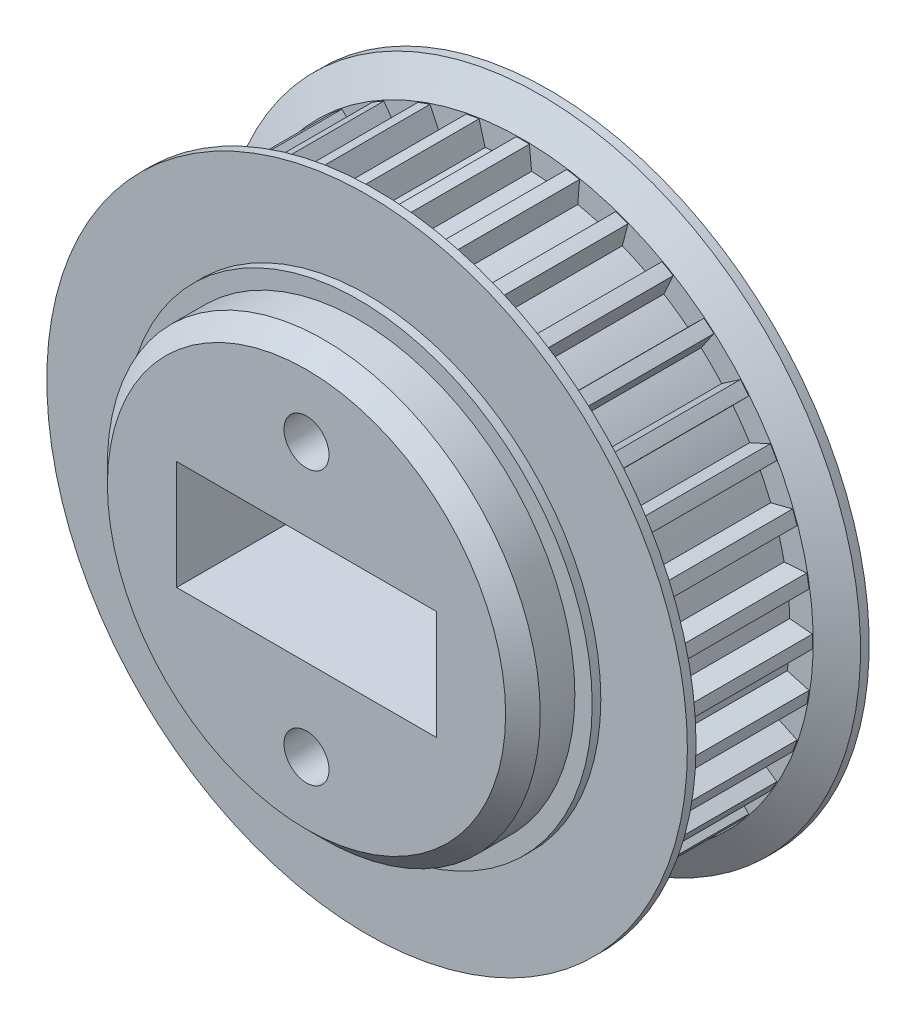
from build123d import *
from OCP.BRepFilletAPI import BRepFilletAPI_MakeChamfer
from build123d.topology import SkipClean

# Parameters (mm, degrees)
CROQUIS1_R              = 2
SALIENTE_EXTRUIR1_DEPTH = 7.5
CROQUIS2_R              = 18.5
CROQUIS2_R_2            = 2
SALIENTE_EXTRUIR2_DEPTH = 1.5
SALIENTE_EXTRUIR4_START = 6
CROQUIS4_R              = 7.5
CROQUIS4_R_2            = 2
SALIENTE_EXTRUIR4_DEPTH = 6
SALIENTE_EXTRUIR6_START = 1.5
CROQUIS6_R              = 18.5
CROQUIS6_R_2            = 2
SALIENTE_EXTRUIR6_DEPTH = 1.5
SALIENTE_EXTRUIR5_START = 0.5
CROQUIS5_R              = 13.5
CROQUIS5_R_2            = 2
SALIENTE_EXTRUIR5_DEPTH = 0.5
CHAFL_N2_SIZE           = 1
CHAFL_N2_SIZE2          = 1.732050808
CROQUIS3_R              = 12.5
CROQUIS3_R_2            = 2
SALIENTE_EXTRUIR7_DEPTH = 3.5
CHAFL_N4_SIZE           = 1
CROQUIS7_R              = 13.5
CROQUIS7_R_2            = 2
SALIENTE_EXTRUIR8_DEPTH = 0.5
CROQUIS8_R              = 1.3
CROQUIS8_W              = 15
CROQUIS8_H              = 6.3
CORTAR_EXTRUIR1_DEPTH   = 27
CROQUIS9_R              = 1.3
CORTAR_EXTRUIR2_DEPTH   = 33.04293994


with BuildPart() as part:
    # Croquis1 → Saliente-Extruir1 (new body)
    with BuildSketch(Plane.XY):
        with BuildLine():
            Line((-0.375, 16.714216942), (-0.5, 15.410313844))
            ThreePointArc((-0.5, 15.410313844), (-1.343804123, 15.359751406), (-2.18356904, 15.263020639))
            Line((-2.18356904, 15.263020639), (-2.533090406, 16.525408497))
            ThreePointArc((-2.533090406, 16.525408497), (-2.903123715, 16.464432747), (-3.271696221, 16.395172363))
            Line((-3.271696221, 16.395172363), (-3.168376793, 15.089372461))
            ThreePointArc((-3.168376793, 15.089372461), (-3.99058156, 14.893053132), (-4.800791439, 14.651968275))
            Line((-4.800791439, 14.651968275), (-5.364214141, 15.834483876))
            ThreePointArc((-5.364214141, 15.834483876), (-5.718037486, 15.710178876), (-6.068983607, 15.577968769))
            Line((-6.068983607, 15.577968769), (-5.74048406, 14.309948132))
            ThreePointArc((-5.74048406, 14.309948132), (-6.516107195, 13.973836975), (-7.27214422, 13.595723269))
            Line((-7.27214422, 13.595723269), (-8.032348945, 14.662436476))
            ThreePointArc((-8.032348945, 14.662436476), (-8.35921158, 14.478579169), (-8.681867997, 14.287436476))
            Line((-8.681867997, 14.287436476), (-8.138169624, 13.095723269))
            ThreePointArc((-8.138169624, 13.095723269), (-8.843644211, 12.630032852), (-9.522536579, 12.126379092))
            Line((-9.522536579, 12.126379092), (-10.45642489, 13.044878363))
            ThreePointArc((-10.45642489, 13.044878363), (-10.746395261, 12.80705516), (-11.030958222, 12.562787656))
            Line((-11.030958222, 12.562787656), (-10.288581022, 11.483591482))
            ThreePointArc((-10.288581022, 11.483591482), (-10.902471572, 10.902471572), (-11.483591482, 10.288581022))
            Line((-11.483591482, 10.288581022), (-12.562787656, 11.030958222))
            ThreePointArc((-12.562787656, 11.030958222), (-12.80705516, 10.746395261), (-13.044878363, 10.45642489))
            Line((-13.044878363, 10.45642489), (-12.126379092, 9.522536579))
            ThreePointArc((-12.126379092, 9.522536579), (-12.630032852, 8.843644211), (-13.095723269, 8.138169624))
            Line((-13.095723269, 8.138169624), (-14.287436476, 8.681867997))
            ThreePointArc((-14.287436476, 8.681867997), (-14.478579169, 8.35921158), (-14.662436476, 8.032348945))
            Line((-14.662436476, 8.032348945), (-13.595723269, 7.27214422))
            ThreePointArc((-13.595723269, 7.27214422), (-13.973836975, 6.516107195), (-14.309948132, 5.74048406))
            Line((-14.309948132, 5.74048406), (-15.577968769, 6.068983607))
            ThreePointArc((-15.577968769, 6.068983607), (-15.710178876, 5.718037486), (-15.834483876, 5.364214141))
            Line((-15.834483876, 5.364214141), (-14.651968275, 4.800791439))
            ThreePointArc((-14.651968275, 4.800791439), (-14.893053132, 3.99058156), (-15.089372461, 3.168376793))
            Line((-15.089372461, 3.168376793), (-16.395172363, 3.271696221))
            ThreePointArc((-16.395172363, 3.271696221), (-16.464432747, 2.903123715), (-16.525408497, 2.533090406))
            Line((-16.525408497, 2.533090406), (-15.263020639, 2.18356904))
            ThreePointArc((-15.263020639, 2.18356904), (-15.359751406, 1.343804123), (-15.410313844, 0.5))
            Line((-15.410313844, 0.5), (-16.714216942, 0.375))
            ThreePointArc((-16.714216942, 0.375), (-16.718423161, 0), (-16.714216942, -0.375))
            Line((-16.714216942, -0.375), (-15.410313844, -0.5))
            ThreePointArc((-15.410313844, -0.5), (-15.359751406, -1.343804123), (-15.263020639, -2.18356904))
            Line((-15.263020639, -2.18356904), (-16.525408497, -2.533090406))
            ThreePointArc((-16.525408497, -2.533090406), (-16.464432747, -2.903123715), (-16.395172363, -3.271696221))
            Line((-16.395172363, -3.271696221), (-15.089372461, -3.168376793))
            ThreePointArc((-15.089372461, -3.168376793), (-14.893053132, -3.99058156), (-14.651968275, -4.800791439))
            Line((-14.651968275, -4.800791439), (-15.834483876, -5.364214141))
            ThreePointArc((-15.834483876, -5.364214141), (-15.710178876, -5.718037486), (-15.577968769, -6.068983607))
            Line((-15.577968769, -6.068983607), (-14.309948132, -5.74048406))
            ThreePointArc((-14.309948132, -5.74048406), (-13.973836975, -6.516107195), (-13.595723269, -7.27214422))
            Line((-13.595723269, -7.27214422), (-14.662436476, -8.032348945))
            ThreePointArc((-14.662436476, -8.032348945), (-14.478579169, -8.35921158), (-14.287436476, -8.681867997))
            Line((-14.287436476, -8.681867997), (-13.095723269, -8.138169624))
            ThreePointArc((-13.095723269, -8.138169624), (-12.630032852, -8.843644211), (-12.126379092, -9.522536579))
            Line((-12.126379092, -9.522536579), (-13.044878363, -10.45642489))
            ThreePointArc((-13.044878363, -10.45642489), (-12.80705516, -10.746395261), (-12.562787656, -11.030958222))
            Line((-12.562787656, -11.030958222), (-11.483591482, -10.288581022))
            ThreePointArc((-11.483591482, -10.288581022), (-10.902471572, -10.902471572), (-10.288581022, -11.483591482))
            Line((-10.288581022, -11.483591482), (-11.030958222, -12.562787656))
            ThreePointArc((-11.030958222, -12.562787656), (-10.746395261, -12.80705516), (-10.45642489, -13.044878363))
            Line((-10.45642489, -13.044878363), (-9.522536579, -12.126379092))
            ThreePointArc((-9.522536579, -12.126379092), (-8.843644211, -12.630032852), (-8.138169624, -13.095723269))
            Line((-8.138169624, -13.095723269), (-8.681867997, -14.287436476))
            ThreePointArc((-8.681867997, -14.287436476), (-8.35921158, -14.478579169), (-8.032348945, -14.662436476))
            Line((-8.032348945, -14.662436476), (-7.27214422, -13.595723269))
            ThreePointArc((-7.27214422, -13.595723269), (-6.516107195, -13.973836975), (-5.74048406, -14.309948132))
            Line((-5.74048406, -14.309948132), (-6.068983607, -15.577968769))
            ThreePointArc((-6.068983607, -15.577968769), (-5.718037486, -15.710178876), (-5.364214141, -15.834483876))
            Line((-5.364214141, -15.834483876), (-4.800791439, -14.651968275))
            ThreePointArc((-4.800791439, -14.651968275), (-3.99058156, -14.893053132), (-3.168376793, -15.089372461))
            Line((-3.168376793, -15.089372461), (-3.271696221, -16.395172363))
            ThreePointArc((-3.271696221, -16.395172363), (-2.903123715, -16.464432747), (-2.533090406, -16.525408497))
            Line((-2.533090406, -16.525408497), (-2.18356904, -15.263020639))
            ThreePointArc((-2.18356904, -15.263020639), (-1.343804123, -15.359751406), (-0.5, -15.410313844))
            Line((-0.5, -15.410313844), (-0.375, -16.714216942))
            ThreePointArc((-0.375, -16.714216942), (0, -16.718423161), (0.375, -16.714216942))
            Line((0.375, -16.714216942), (0.5, -15.410313844))
            ThreePointArc((0.5, -15.410313844), (1.343804123, -15.359751406), (2.18356904, -15.263020639))
            Line((2.18356904, -15.263020639), (2.533090406, -16.525408497))
            ThreePointArc((2.533090406, -16.525408497), (2.903123715, -16.464432747), (3.271696221, -16.395172363))
            Line((3.271696221, -16.395172363), (3.168376793, -15.089372461))
            ThreePointArc((3.168376793, -15.089372461), (3.99058156, -14.893053132), (4.800791439, -14.651968275))
            Line((4.800791439, -14.651968275), (5.364214141, -15.834483876))
            ThreePointArc((5.364214141, -15.834483876), (5.718037486, -15.710178876), (6.068983607, -15.577968769))
            Line((6.068983607, -15.577968769), (5.74048406, -14.309948132))
            ThreePointArc((5.74048406, -14.309948132), (6.516107195, -13.973836975), (7.27214422, -13.595723269))
            Line((7.27214422, -13.595723269), (8.032348945, -14.662436476))
            ThreePointArc((8.032348945, -14.662436476), (8.35921158, -14.478579169), (8.681867997, -14.287436476))
            Line((8.681867997, -14.287436476), (8.138169624, -13.095723269))
            ThreePointArc((8.138169624, -13.095723269), (8.843644211, -12.630032852), (9.522536579, -12.126379092))
            Line((9.522536579, -12.126379092), (10.45642489, -13.044878363))
            ThreePointArc((10.45642489, -13.044878363), (10.746395261, -12.80705516), (11.030958222, -12.562787656))
            Line((11.030958222, -12.562787656), (10.288581022, -11.483591482))
            ThreePointArc((10.288581022, -11.483591482), (10.902471572, -10.902471572), (11.483591482, -10.288581022))
            Line((11.483591482, -10.288581022), (12.562787656, -11.030958222))
            ThreePointArc((12.562787656, -11.030958222), (12.80705516, -10.746395261), (13.044878363, -10.45642489))
            Line((13.044878363, -10.45642489), (12.126379092, -9.522536579))
            ThreePointArc((12.126379092, -9.522536579), (12.630032852, -8.843644211), (13.095723269, -8.138169624))
            Line((13.095723269, -8.138169624), (14.287436476, -8.681867997))
            ThreePointArc((14.287436476, -8.681867997), (14.478579169, -8.35921158), (14.662436476, -8.032348945))
            Line((14.662436476, -8.032348945), (13.595723269, -7.27214422))
            ThreePointArc((13.595723269, -7.27214422), (13.973836975, -6.516107195), (14.309948132, -5.74048406))
            Line((14.309948132, -5.74048406), (15.577968769, -6.068983607))
            ThreePointArc((15.577968769, -6.068983607), (15.710178876, -5.718037486), (15.834483876, -5.364214141))
            Line((15.834483876, -5.364214141), (14.651968275, -4.800791439))
            ThreePointArc((14.651968275, -4.800791439), (14.893053132, -3.99058156), (15.089372461, -3.168376793))
            Line((15.089372461, -3.168376793), (16.395172363, -3.271696221))
            ThreePointArc((16.395172363, -3.271696221), (16.464432747, -2.903123715), (16.525408497, -2.533090406))
            Line((16.525408497, -2.533090406), (15.263020639, -2.18356904))
            ThreePointArc((15.263020639, -2.18356904), (15.359751406, -1.343804123), (15.410313844, -0.5))
            Line((15.410313844, -0.5), (16.714216942, -0.375))
            ThreePointArc((16.714216942, -0.375), (16.718423161, 0), (16.714216942, 0.375))
            Line((16.714216942, 0.375), (15.410313844, 0.5))
            ThreePointArc((15.410313844, 0.5), (15.359751406, 1.343804123), (15.263020639, 2.18356904))
            Line((15.263020639, 2.18356904), (16.525408497, 2.533090406))
            ThreePointArc((16.525408497, 2.533090406), (16.464432747, 2.903123715), (16.395172363, 3.271696221))
            Line((16.395172363, 3.271696221), (15.089372461, 3.168376793))
            ThreePointArc((15.089372461, 3.168376793), (14.893053132, 3.99058156), (14.651968275, 4.800791439))
            Line((14.651968275, 4.800791439), (15.834483876, 5.364214141))
            ThreePointArc((15.834483876, 5.364214141), (15.710178876, 5.718037486), (15.577968769, 6.068983607))
            Line((15.577968769, 6.068983607), (14.309948132, 5.74048406))
            ThreePointArc((14.309948132, 5.74048406), (13.973836975, 6.516107195), (13.595723269, 7.27214422))
            Line((13.595723269, 7.27214422), (14.662436476, 8.032348945))
            ThreePointArc((14.662436476, 8.032348945), (14.478579169, 8.35921158), (14.287436476, 8.681867997))
            Line((14.287436476, 8.681867997), (13.095723269, 8.138169624))
            ThreePointArc((13.095723269, 8.138169624), (12.630032852, 8.843644211), (12.126379092, 9.522536579))
            Line((12.126379092, 9.522536579), (13.044878363, 10.45642489))
            ThreePointArc((13.044878363, 10.45642489), (12.80705516, 10.746395261), (12.562787656, 11.030958222))
            Line((12.562787656, 11.030958222), (11.483591482, 10.288581022))
            ThreePointArc((11.483591482, 10.288581022), (10.902471572, 10.902471572), (10.288581022, 11.483591482))
            Line((10.288581022, 11.483591482), (11.030958222, 12.562787656))
            ThreePointArc((11.030958222, 12.562787656), (10.746395261, 12.80705516), (10.45642489, 13.044878363))
            Line((10.45642489, 13.044878363), (9.522536579, 12.126379092))
            ThreePointArc((9.522536579, 12.126379092), (8.843644211, 12.630032852), (8.138169624, 13.095723269))
            Line((8.138169624, 13.095723269), (8.681867997, 14.287436476))
            ThreePointArc((8.681867997, 14.287436476), (8.35921158, 14.478579169), (8.032348945, 14.662436476))
            Line((8.032348945, 14.662436476), (7.27214422, 13.595723269))
            ThreePointArc((7.27214422, 13.595723269), (6.516107195, 13.973836975), (5.74048406, 14.309948132))
            Line((5.74048406, 14.309948132), (6.068983607, 15.577968769))
            ThreePointArc((6.068983607, 15.577968769), (5.718037486, 15.710178876), (5.364214141, 15.834483876))
            Line((5.364214141, 15.834483876), (4.800791439, 14.651968275))
            ThreePointArc((4.800791439, 14.651968275), (3.99058156, 14.893053132), (3.168376793, 15.089372461))
            Line((3.168376793, 15.089372461), (3.271696221, 16.395172363))
            ThreePointArc((3.271696221, 16.395172363), (2.903123715, 16.464432747), (2.533090406, 16.525408497))
            Line((2.533090406, 16.525408497), (2.18356904, 15.263020639))
            ThreePointArc((2.18356904, 15.263020639), (1.343804123, 15.359751406), (0.5, 15.410313844))
            Line((0.5, 15.410313844), (0.375, 16.714216942))
            ThreePointArc((0.375, 16.714216942), (0, 16.718423161), (-0.375, 16.714216942))
        make_face()
        Circle(CROQUIS1_R, mode=Mode.SUBTRACT)
    extrude(amount=SALIENTE_EXTRUIR1_DEPTH)

    # Croquis2 → Saliente-Extruir2 (add)
    with BuildSketch(Plane.XY.offset(7.5)):
        Circle(CROQUIS2_R)
        Circle(CROQUIS2_R_2, mode=Mode.SUBTRACT)
    extrude(amount=SALIENTE_EXTRUIR2_DEPTH)

    # Croquis4 → Saliente-Extruir4 (add)
    with BuildSketch(Plane(origin=(0, 0, 0), x_dir=(-1, 0, 0), z_dir=(0, 0, -1)).offset(SALIENTE_EXTRUIR4_START)):
        with Locations(Location((0, 0, 0), (0, 0, 180))):
            Circle(CROQUIS4_R)
        Circle(CROQUIS4_R_2, mode=Mode.SUBTRACT)
    extrude(amount=-SALIENTE_EXTRUIR4_DEPTH)

    # Croquis6 → Saliente-Extruir6 (add)
    with SkipClean():  # the faces are left unmerged after this step: merging them gives an invalid solid
        with BuildSketch(Plane(origin=(0, 0, 0), x_dir=(-1, 0, 0), z_dir=(0, 0, -1)).offset(SALIENTE_EXTRUIR6_START)):
            with Locations(Location((0, 0, 0), (0, 0, 180))):
                Circle(CROQUIS6_R)
            Circle(CROQUIS6_R_2, mode=Mode.SUBTRACT)
        extrude(amount=-SALIENTE_EXTRUIR6_DEPTH)

    # Croquis5 → Saliente-Extruir5 (add)
    with SkipClean():  # the faces are left unmerged after this step: merging them gives an invalid solid
        with BuildSketch(Plane(origin=(0, 0, -1.5), x_dir=(-1, 0, 0), z_dir=(0, 0, -1)).offset(SALIENTE_EXTRUIR5_START)):
            Circle(CROQUIS5_R)
            Circle(CROQUIS5_R_2, mode=Mode.SUBTRACT)
        extrude(amount=-SALIENTE_EXTRUIR5_DEPTH)

    # Chaflán2: one chamfer whose edges measure the first distance from different faces: ONE call of the kernel's chamfer builder (chamfer() names one face for all edges)
    chafl_n2_edges_1 = [part.edges().sort_by_distance(p)[0] for p in [
        (-18.5, 0, 7.5),
    ]]
    chafl_n2_side_1 = [part.faces().sort_by_distance(p)[0] for p in [
        (-18.5, 0, 8.25),
    ]]
    chafl_n2_edges_2 = [part.edges().sort_by_distance(p)[0] for p in [
        (-18.5, 0, 0),
    ]]
    chafl_n2_side_2 = [part.faces().sort_by_distance(p)[0] for p in [
        (-18.5, 0, -0.75),
    ]]
    chafl_n2 = BRepFilletAPI_MakeChamfer(part.part.solid().wrapped)
    for e in chafl_n2_edges_1:
        chafl_n2.Add(CHAFL_N2_SIZE, CHAFL_N2_SIZE2, e.wrapped, chafl_n2_side_1[0].wrapped)  # the first distance lies on this face
    for e in chafl_n2_edges_2:
        chafl_n2.Add(CHAFL_N2_SIZE, CHAFL_N2_SIZE2, e.wrapped, chafl_n2_side_2[0].wrapped)  # the first distance lies on this face
    add(Compound.cast(chafl_n2.Shape()), mode=Mode.REPLACE)

    # Croquis3 → Saliente-Extruir7 (add)
    with BuildSketch(Plane.XY.offset(9)):
        Circle(CROQUIS3_R)
        with Locations(Location((0, 0, 0), (0, 0, 180))):
            Circle(CROQUIS3_R_2, mode=Mode.SUBTRACT)
    extrude(amount=SALIENTE_EXTRUIR7_DEPTH)

    # Chaflán4
    chafl_n4_edges = [part.edges().sort_by_distance(p)[0] for p in [
        (-7.5, 0, -6),
        (-12.5, 0, 12.5),
    ]]
    chamfer(chafl_n4_edges, length=CHAFL_N4_SIZE)

    # Croquis7 → Saliente-Extruir8 (add)
    with BuildSketch(Plane.XY.offset(9)):
        with Locations(Location((0, 0, 0), (0, 0, 180))):
            Circle(CROQUIS7_R)
        with Locations(Location((0, 0, 0), (0, 0, 180))):
            Circle(CROQUIS7_R_2, mode=Mode.SUBTRACT)
    extrude(amount=SALIENTE_EXTRUIR8_DEPTH)

    # Croquis8 → Cortar-Extruir1 (cut)
    with BuildSketch(Plane.XY):
        with Locations((0, 7.875631857)):
            Circle(CROQUIS8_R)
        with Locations((0, -7.875631857)):
            Circle(CROQUIS8_R)
        Rectangle(CROQUIS8_W, CROQUIS8_H)
    extrude(amount=CORTAR_EXTRUIR1_DEPTH, mode=Mode.SUBTRACT)

    # Croquis9 → Cortar-Extruir2 (cut, through all)
    with SkipClean():  # the faces are left unmerged after this step: merging them gives an invalid solid
        with BuildSketch(Plane.XY.offset(12.5)):
            with Locations(Location((0, 7.875631857, 0), (0, 0, 201.382346574))):
                Circle(CROQUIS9_R)
            with Locations(Location((0, -7.875631857, 0), (0, 0, 158.617653426))):
                Circle(CROQUIS9_R)
        extrude(amount=-CORTAR_EXTRUIR2_DEPTH, mode=Mode.SUBTRACT)


solid = part.part
